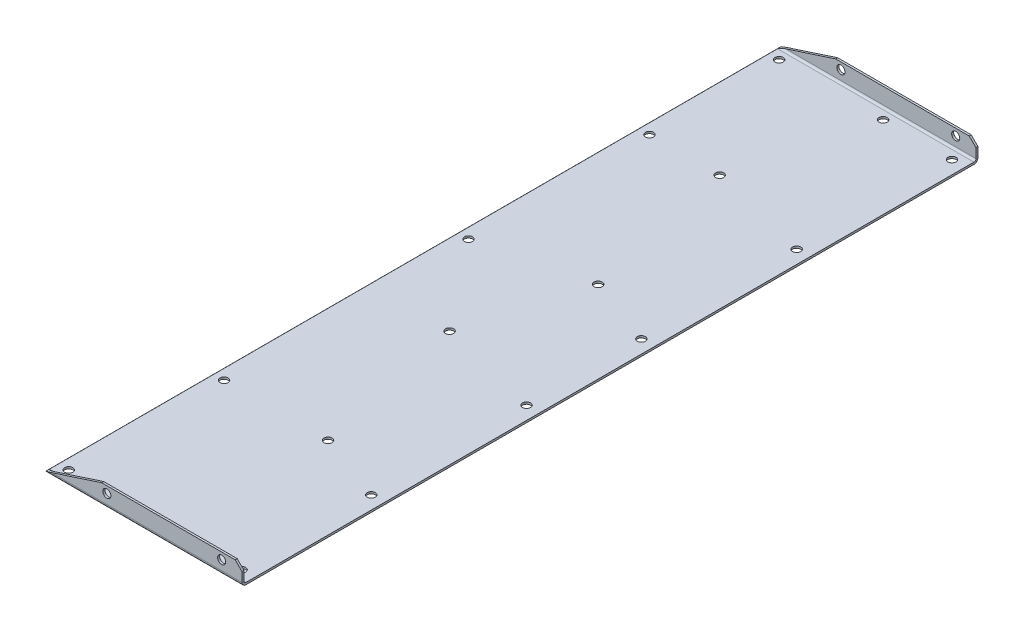
from build123d import *

# Parameters (mm, degrees)
ESTRUSIONE_SOTTILE1_DEPTH = 150
SCHIZZO2_R                = 3
TAGLIO_ESTRUSIONE1_DEPTH  = 566.464410905
TAGLIO_ESTRUSIONE2_DEPTH  = 566.464410905
SCHIZZO4_R                = 3
TAGLIO_ESTRUSIONE3_DEPTH  = 10
SMUSSO1_SIZE              = 5


with BuildPart() as part:
    # Schizzo1 → Estrusione-Sottile1 (new body)
    with BuildSketch(Plane(origin=(0, 0, 0), x_dir=(0, 0, -1), z_dir=(1, 0, 0))):
        with BuildLine():
            Line((-272.5, 15), (-272.5, 3))
            ThreePointArc((-272.5, 3), (-271.621320344, 0.878679656), (-269.5, 0))
            Line((-269.5, 0), (269.5, 0))
            ThreePointArc((269.5, 0), (271.621320344, 0.878679656), (272.5, 3))
            Line((272.5, 3), (272.5, 15))
            Line((272.5, 15), (271, 15))
            Line((271, 15), (271, 3))
            ThreePointArc((271, 3), (270.560660172, 1.939339828), (269.5, 1.5))
            Line((269.5, 1.5), (-269.5, 1.5))
            ThreePointArc((-269.5, 1.5), (-270.560660172, 1.939339828), (-271, 3))
            Line((-271, 3), (-271, 15))
            Line((-271, 15), (-272.5, 15))
        make_face()
    extrude(amount=ESTRUSIONE_SOTTILE1_DEPTH)

    # Schizzo2 → Taglio-Estrusione1 (cut, through all)
    with BuildSketch(Plane.XY.offset(272.5)):
        with Locations((135, 10)):
            Circle(SCHIZZO2_R)
        with Locations((50, 10)):
            Circle(SCHIZZO2_R)
    extrude(amount=-TAGLIO_ESTRUSIONE1_DEPTH, mode=Mode.SUBTRACT)

    # Schizzo3 → Taglio-Estrusione2 (cut, through all)
    with BuildSketch(Plane.XY.offset(272.5)):
        Polygon((4.5, 1.462138633), (46.165253058, 15), (0, 15), (0, 0), (4.5, 0), align=None)
    extrude(amount=-TAGLIO_ESTRUSIONE2_DEPTH, mode=Mode.SUBTRACT)

    # Schizzo4 → Taglio-Estrusione3 (cut)
    with BuildSketch(Plane(origin=(0, 1.5, 0), x_dir=(1, 0, 0), z_dir=(0, 1, 0))):
        with Locations(Location((12.2458607, 33, 0), (0, 0, 270))):
            Circle(SCHIZZO4_R)
        with Locations(Location((12.2458607, 167, 0), (0, 0, 270))):
            Circle(SCHIZZO4_R)
        with Locations(Location((12.2458607, 263, 0), (0, 0, 270))):
            Circle(SCHIZZO4_R)
        with Locations(Location((12.2458607, -263, 0), (0, 0, 270))):
            Circle(SCHIZZO4_R)
        with Locations(Location((12.2458607, -148, 0), (0, 0, 270))):
            Circle(SCHIZZO4_R)
        with Locations(Location((64.2458607, 167, 0), (0, 0, 270))):
            Circle(SCHIZZO4_R)
        with Locations(Location((89.2458607, 52, 0), (0, 0, 270))):
            Circle(SCHIZZO4_R)
        with Locations(Location((64.2458607, -33, 0), (0, 0, 270))):
            Circle(SCHIZZO4_R)
        with Locations(Location((89.2458607, -148, 0), (0, 0, 270))):
            Circle(SCHIZZO4_R)
        with Locations(Location((64.2458607, -263, 0), (0, 0, 270))):
            Circle(SCHIZZO4_R)
        with Locations(Location((140.2458607, -167, 0), (0, 0, 270))):
            Circle(SCHIZZO4_R)
        with Locations(Location((140.2458607, -52, 0), (0, 0, 270))):
            Circle(SCHIZZO4_R)
        with Locations(Location((140.2458607, 33, 0), (0, 0, 270))):
            Circle(SCHIZZO4_R)
        with Locations(Location((140.2458607, 148, 0), (0, 0, 270))):
            Circle(SCHIZZO4_R)
        with Locations(Location((89.2458607, 263, 0), (0, 0, 270))):
            Circle(SCHIZZO4_R)
        with Locations(Location((140.2458607, 263, 0), (0, 0, 270))):
            Circle(SCHIZZO4_R)
        with Locations(Location((140.2458607, -263, 0), (0, 0, 270))):
            Circle(SCHIZZO4_R)
    extrude(amount=-TAGLIO_ESTRUSIONE3_DEPTH, mode=Mode.SUBTRACT)

    # Smusso1
    smusso1_edges = [part.edges().sort_by_distance(p)[0] for p in [
        (150, 15, -271.75),
        (150, 15, 271.75),
    ]]
    chamfer(smusso1_edges, length=SMUSSO1_SIZE)


solid = part.part
